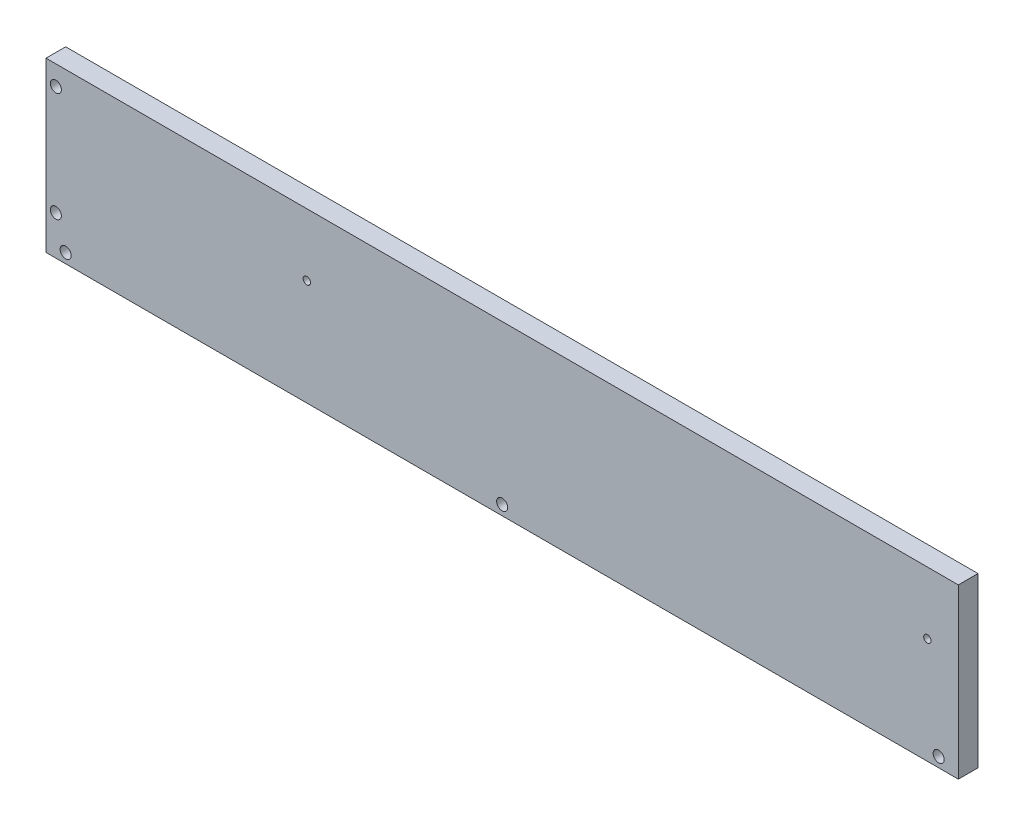
from build123d import *

# Parameters (mm, degrees)
SKETCH1_W           = 294.64
SKETCH1_H           = 54.35
SKETCH1_R           = 1.7859375
SKETCH1_R_2         = 1.190625
BOSS_EXTRUDE1_DEPTH = 6.35


with BuildPart() as part:
    # Sketch1 → Boss-Extrude1 (new body)
    with BuildSketch(Plane.XY):
        with Locations((147.32, 27.175)):
            Rectangle(SKETCH1_W, SKETCH1_H)
        with Locations((3.175, 48)):
            Circle(SKETCH1_R, mode=Mode.SUBTRACT)
        with Locations((3.175, 12.7)):
            Circle(SKETCH1_R, mode=Mode.SUBTRACT)
        with Locations((6.35, 3.175)):
            Circle(SKETCH1_R, mode=Mode.SUBTRACT)
        with Locations((288.29, 3.175)):
            Circle(SKETCH1_R, mode=Mode.SUBTRACT)
        with Locations((147.32, 3.175)):
            Circle(SKETCH1_R, mode=Mode.SUBTRACT)
        with Locations((84.24, 34.25)):
            Circle(SKETCH1_R_2, mode=Mode.SUBTRACT)
        with Locations((284.64, 34.25)):
            Circle(SKETCH1_R_2, mode=Mode.SUBTRACT)
    extrude(amount=BOSS_EXTRUDE1_DEPTH)


solid = part.part
